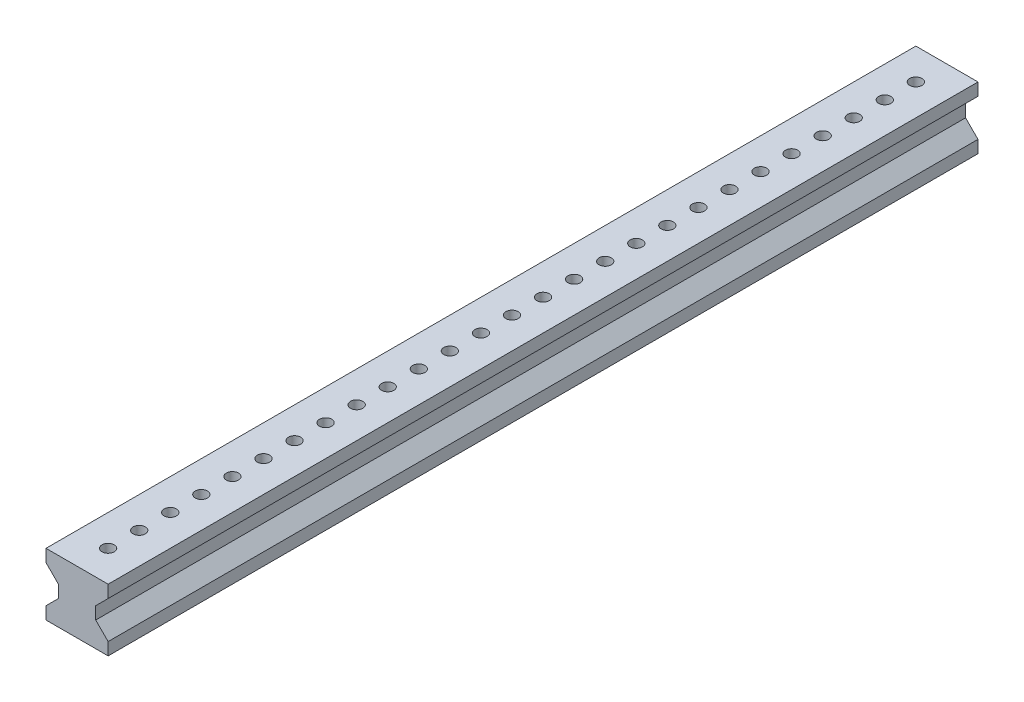
from build123d import *

# Parameters (mm, degrees)
BOSS_EXTRUDE1_DEPTH = 355.6
SKETCH3_R           = 2.5
CUT_EXTRUDE1_DEPTH  = 25.4


with BuildPart() as part:
    # Sketch1 → Boss-Extrude1 (new body)
    with BuildSketch(Plane.XY):
        Polygon((12.7, 12.7), (-12.7, 12.7), (-12.7, 7.62), (-7.62, 2.54), (-7.62, -2.54), (-12.7, -7.62), (-12.7, -12.7), (12.7, -12.7), (12.7, -7.62), (7.62, -2.54), (7.62, 2.54), (12.7, 7.62), align=None)
    extrude(amount=BOSS_EXTRUDE1_DEPTH)

    # Sketch3 → Cut-Extrude1 (cut)
    with BuildSketch(Plane(origin=(0, 12.7, 0), x_dir=(1, 0, 0), z_dir=(0, 1, 0))):
        with Locations(Location((0, -342.9, 0), (0, 0, 270))):
            Circle(SKETCH3_R)
        with Locations(Location((0, -330.2, 0), (0, 0, 270))):
            Circle(SKETCH3_R)
        with Locations(Location((0, -317.5, 0), (0, 0, 270))):
            Circle(SKETCH3_R)
        with Locations(Location((0, -304.8, 0), (0, 0, 270))):
            Circle(SKETCH3_R)
        with Locations(Location((0, -292.1, 0), (0, 0, 270))):
            Circle(SKETCH3_R)
        with Locations(Location((0, -279.4, 0), (0, 0, 270))):
            Circle(SKETCH3_R)
        with Locations(Location((0, -266.7, 0), (0, 0, 270))):
            Circle(SKETCH3_R)
        with Locations(Location((0, -254, 0), (0, 0, 270))):
            Circle(SKETCH3_R)
        with Locations(Location((0, -241.3, 0), (0, 0, 270))):
            Circle(SKETCH3_R)
        with Locations(Location((0, -228.6, 0), (0, 0, 270))):
            Circle(SKETCH3_R)
        with Locations(Location((0, -215.9, 0), (0, 0, 270))):
            Circle(SKETCH3_R)
        with Locations(Location((0, -203.2, 0), (0, 0, 270))):
            Circle(SKETCH3_R)
        with Locations(Location((0, -190.5, 0), (0, 0, 270))):
            Circle(SKETCH3_R)
        with Locations(Location((0, -177.8, 0), (0, 0, 270))):
            Circle(SKETCH3_R)
        with Locations(Location((0, -165.1, 0), (0, 0, 270))):
            Circle(SKETCH3_R)
        with Locations(Location((0, -152.4, 0), (0, 0, 270))):
            Circle(SKETCH3_R)
        with Locations(Location((0, -139.7, 0), (0, 0, 270))):
            Circle(SKETCH3_R)
        with Locations(Location((0, -127, 0), (0, 0, 270))):
            Circle(SKETCH3_R)
        with Locations(Location((0, -114.3, 0), (0, 0, 270))):
            Circle(SKETCH3_R)
        with Locations(Location((0, -101.6, 0), (0, 0, 270))):
            Circle(SKETCH3_R)
        with Locations(Location((0, -88.9, 0), (0, 0, 270))):
            Circle(SKETCH3_R)
        with Locations(Location((0, -76.2, 0), (0, 0, 270))):
            Circle(SKETCH3_R)
        with Locations(Location((0, -63.5, 0), (0, 0, 270))):
            Circle(SKETCH3_R)
        with Locations(Location((0, -50.8, 0), (0, 0, 270))):
            Circle(SKETCH3_R)
        with Locations(Location((0, -38.1, 0), (0, 0, 270))):
            Circle(SKETCH3_R)
        with Locations(Location((0, -25.4, 0), (0, 0, 270))):
            Circle(SKETCH3_R)
        with Locations(Location((0, -12.7, 0), (0, 0, 270))):
            Circle(SKETCH3_R)
    extrude(amount=-CUT_EXTRUDE1_DEPTH, mode=Mode.SUBTRACT)


solid = part.part
